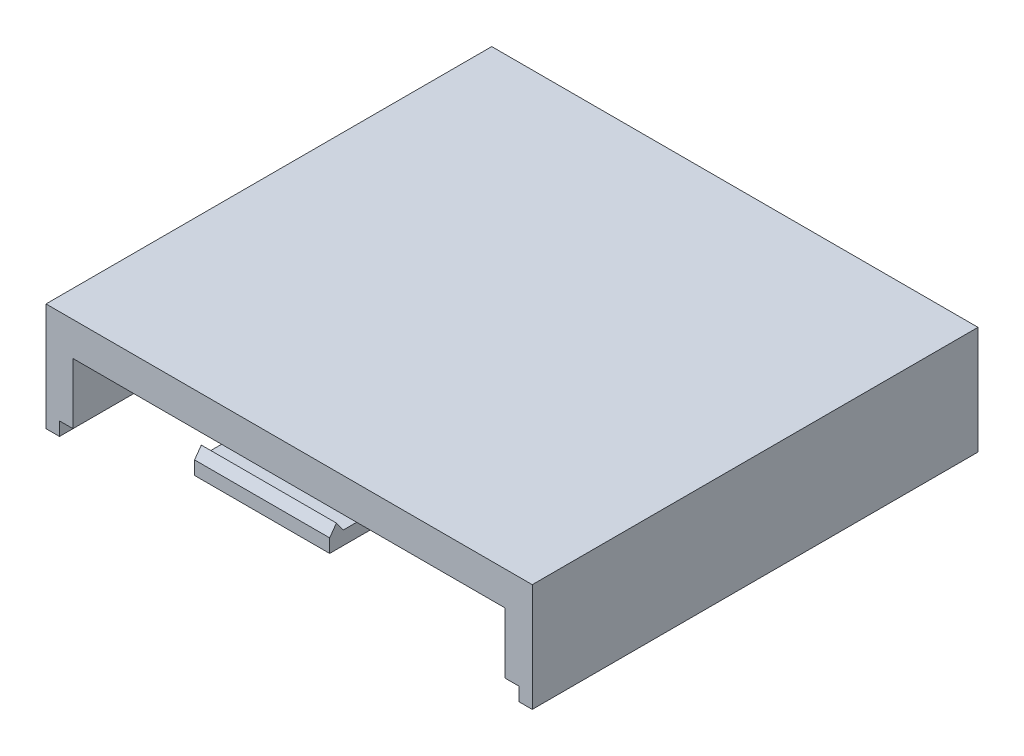
from build123d import *

# Parameters (mm, degrees)
SALIENTE_EXTRUIR1_DEPTH      = 33
SALIENTE_EXTRUIR2_DEPTH      = 1.2
SALIENTE_EXTRUIR3_DEPTH      = 1.2
SALIENTE_EXTRUIR4_DEPTH      = 2
SALIENTE_EXTRUIR4_DEPTH_BACK = 1
CROQUIS4_W                   = 10
CROQUIS4_H                   = 1
SALIENTE_EXTRUIR5_DEPTH      = 10


with BuildPart() as part:
    # Croquis1 → Saliente-Extruir1 (new body)
    with BuildSketch(Plane.XY):
        Polygon((-18, -5.5), (-17, -5.5), (-17, -4.5), (-16, -4.5), (-16, 0), (16, 0), (16, -4.5), (17, -4.5), (17, -5.5), (18, -5.5), (18, 2.5), (-18, 2.5), align=None)
    extrude(amount=SALIENTE_EXTRUIR1_DEPTH)

    # Croquis2 → Saliente-Extruir2 (add)
    with BuildSketch(Plane.XY):
        Polygon((17, -5.5), (-17, -5.5), (-17, -4.5), (-16, -4.5), (-16, 0), (16, 0), (16, -4.5), (17, -4.5), align=None)
    extrude(amount=SALIENTE_EXTRUIR2_DEPTH)

    # Croquis3 → Saliente-Extruir3 (add)
    with BuildSketch(Plane.XY):
        Polygon((5, -5.5), (5, -10.5), (-5, -10.5), (-5, -5.5), (-3.5, -5.5), (-3.5, -8.55), (3.5, -8.55), (3.5, -5.5), align=None)
    extrude(amount=SALIENTE_EXTRUIR3_DEPTH)

    # Croquis4 → Saliente-Extruir4 (add, two sides: drawn at the far end of the back side and taken through both)
    with BuildSketch(Plane.XY.offset(33).offset(-SALIENTE_EXTRUIR4_DEPTH_BACK)):
        with Locations((0, -0.5)):
            Rectangle(CROQUIS4_W, CROQUIS4_H)
    extrude(amount=SALIENTE_EXTRUIR4_DEPTH + SALIENTE_EXTRUIR4_DEPTH_BACK)

    # Croquis5 → Saliente-Extruir5 (add)
    with BuildSketch(Plane(origin=(5, 0, 0), x_dir=(0, 0, -1), z_dir=(1, 0, 0))):
        Polygon((-35, 0), (-34.5, 0.7), (-34, 0), align=None)
    extrude(amount=-SALIENTE_EXTRUIR5_DEPTH)


solid = part.part
